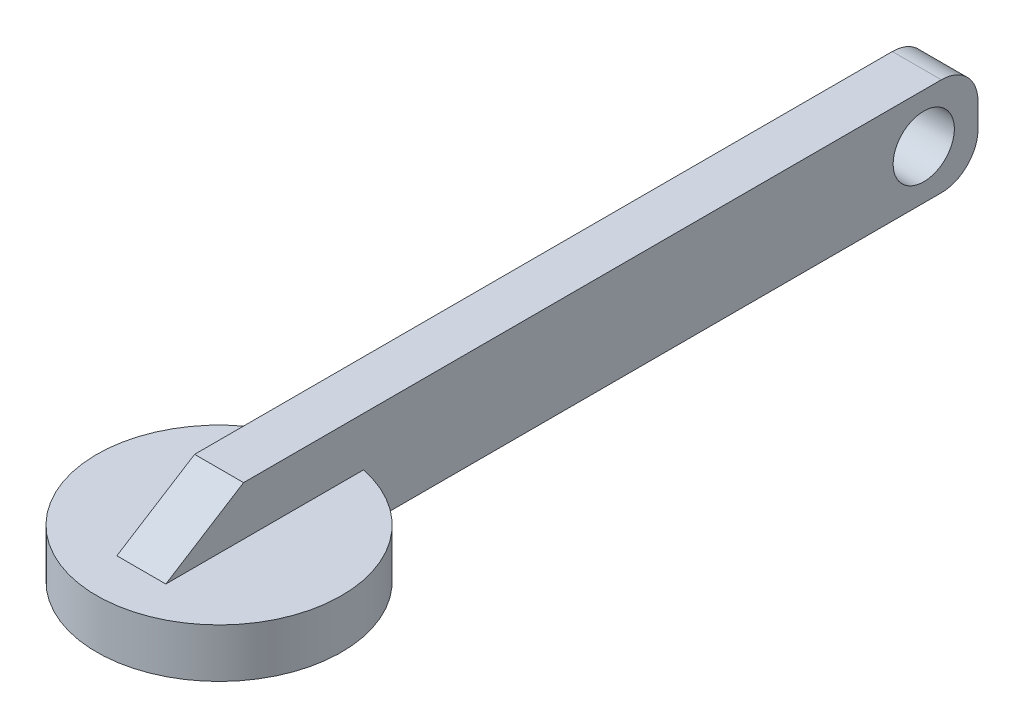
from build123d import *

# Parameters (mm, degrees)
SKETCH1_W           = 4
SKETCH1_H           = 60
BOSS_EXTRUDE1_DEPTH = 8
SKETCH2_R           = 2.5
CUT_EXTRUDE1_DEPTH  = 8
FILLET1_R           = 3
SKETCH3_R           = 10
BOSS_EXTRUDE2_DEPTH = 4
BOSS_EXTRUDE3_DEPTH = 4


with BuildPart() as part:
    # Sketch1 → Boss-Extrude1 (new body)
    with BuildSketch(Plane(origin=(0, 0, 0), x_dir=(1, 0, 0), z_dir=(0, 1, 0))):
        Rectangle(SKETCH1_W, SKETCH1_H)
    extrude(amount=BOSS_EXTRUDE1_DEPTH)

    # Sketch2 → Cut-Extrude1 (cut)
    with BuildSketch(Plane.ZY.offset(2)):
        with Locations((-25.567586356, 4)):
            Circle(SKETCH2_R)
    extrude(amount=-CUT_EXTRUDE1_DEPTH, mode=Mode.SUBTRACT)

    # Fillet1
    fillet1_edges = [part.edges().sort_by_distance(p)[0] for p in [
        (0, 0, -30),
        (0, 8, -30),
    ]]
    fillet(fillet1_edges, radius=FILLET1_R)

    # Sketch3 → Boss-Extrude2 (add)
    with BuildSketch(Plane.XZ):
        with Locations((0, 30)):
            Circle(SKETCH3_R)
    extrude(amount=-BOSS_EXTRUDE2_DEPTH)

    # Sketch4 → Boss-Extrude3 (add)
    with BuildSketch(Plane(origin=(2, 0, 0), x_dir=(0, 0, -1), z_dir=(1, 0, 0))):
        Polygon((-30, 4), (-36.351721889, 4), (-30, 8), align=None)
    extrude(amount=-BOSS_EXTRUDE3_DEPTH)


solid = part.part
